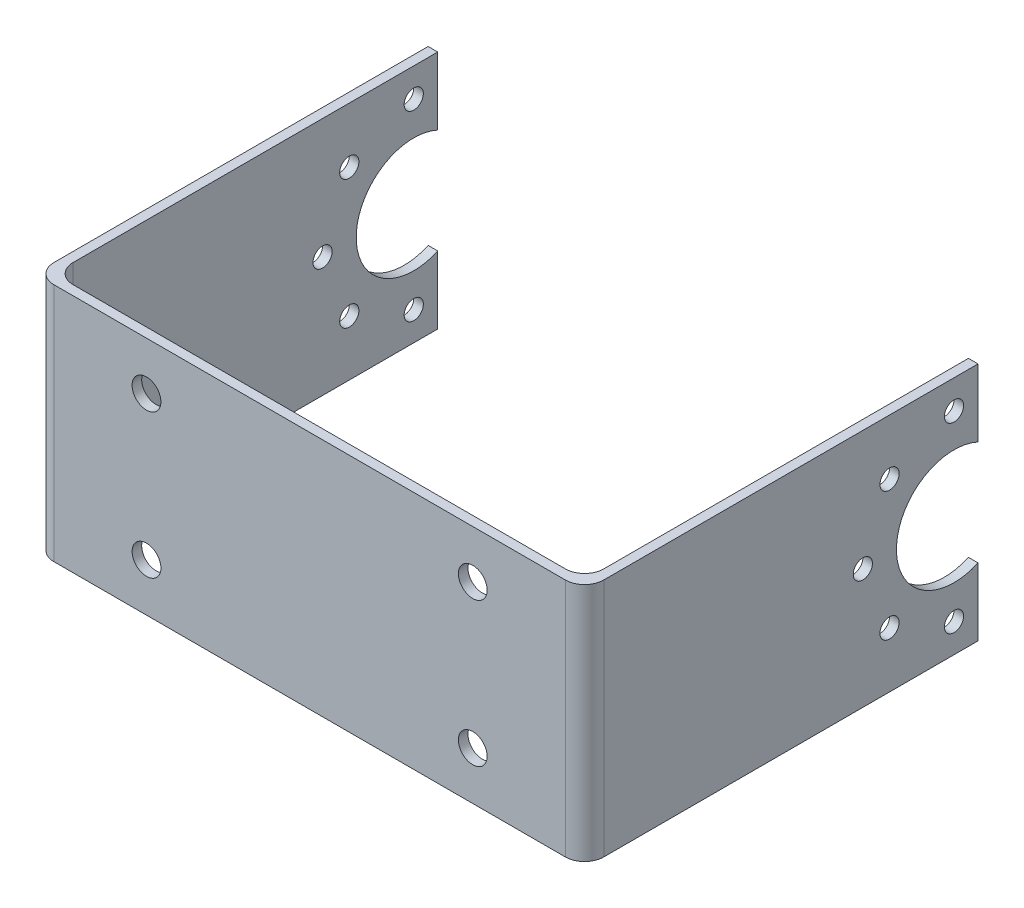
from build123d import *

# Parameters (mm, degrees)
BOSS_EXTRUDE1_DEPTH = 25
SKETCH2_R           = 1
SKETCH2_R_2         = 6
CUT_EXTRUDE1_DEPTH  = 75.488522606
FILLET2_R           = 2
SKETCH3_R           = 1.5
CUT_EXTRUDE2_DEPTH  = 60.304637255


with BuildPart() as part:
    # Sketch1 → Boss-Extrude1 (new body)
    with BuildSketch(Plane(origin=(0, 0, 0), x_dir=(1, 0, 0), z_dir=(0, 1, 0))):
        Polygon((-21.5, 0.5), (33.8, 0.5), (33.8, 40.5), (34.8, 40.5), (34.8, 0.5), (34.8, -0.5), (-22.5, -0.5), (-22.5, 0.5), (-22.5, 40.5), (-21.5, 40.5), align=None)
    extrude(amount=BOSS_EXTRUDE1_DEPTH)

    # Sketch2 → Cut-Extrude1 (cut, through all)
    with BuildSketch(Plane(origin=(34.8, 0, 0), x_dir=(0, 0, -1), z_dir=(1, 0, 0))):
        with Locations((28.5, 12.5)):
            Circle(SKETCH2_R)
        with Locations((38, 12.5)):
            Circle(SKETCH2_R_2)
        with Locations((31.282485579, 19.217514421)):
            Circle(SKETCH2_R)
        with Locations((38, 22)):
            Circle(SKETCH2_R)
        with Locations((38, 3)):
            Circle(SKETCH2_R)
        with Locations((31.282485579, 5.782485579)):
            Circle(SKETCH2_R)
    extrude(amount=-CUT_EXTRUDE1_DEPTH, mode=Mode.SUBTRACT)

    # Fillet2
    fillet2_edges = [part.edges().sort_by_distance(p)[0] for p in [
        (34.8, 12.5, 0.5),
        (-22.5, 12.5, 0.5),
        (-21.5, 12.5, -0.5),
        (33.8, 12.5, -0.5),
    ]]
    fillet(fillet2_edges, radius=FILLET2_R)

    # Sketch3 → Cut-Extrude2 (cut, through all)
    with BuildSketch(Plane.XY.offset(0.5)):
        with Locations((-10.85, 20)):
            Circle(SKETCH3_R)
        with Locations((23.15, 20)):
            Circle(SKETCH3_R)
        with Locations((-10.85, 5)):
            Circle(SKETCH3_R)
        with Locations((23.15, 5)):
            Circle(SKETCH3_R)
    extrude(amount=-CUT_EXTRUDE2_DEPTH, mode=Mode.SUBTRACT)


solid = part.part
